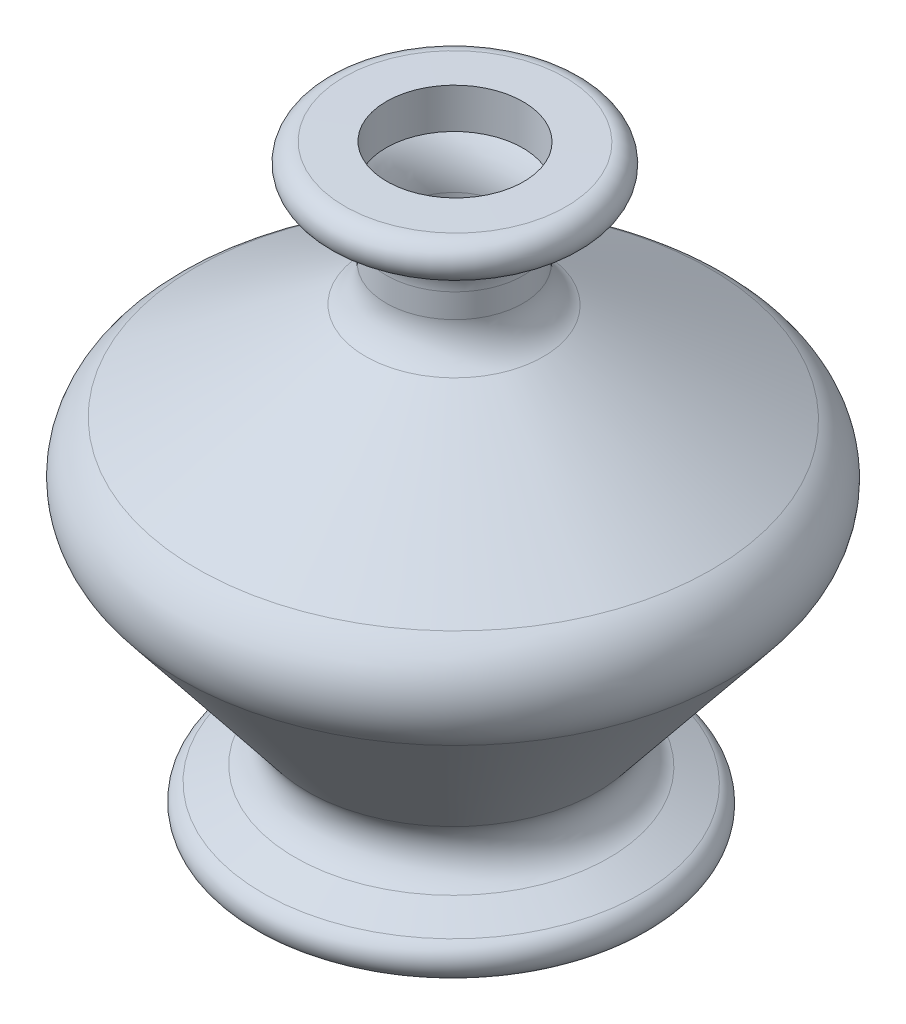
from build123d import *


with BuildPart() as part:
    # Sketch1 → Revolve1 (revolve)
    with BuildSketch(Plane.XY):
        with BuildLine():
            ThreePointArc((-30.112804191, 46.969682677), (-21.984957877, 43.22770443), (-18.705713585, 34.902390995))
            Line((-18.705713585, 34.902390995), (-18.750262239, 28.378005059))
            ThreePointArc((-18.750262239, 28.378005059), (-20.276474461, 22.796589902), (-24.375, 18.712032728))
            Line((-24.375, 18.712032728), (-70.25, -7.773910871))
            ThreePointArc((-70.25, -7.773910871), (-77.957800408, -18.586470041), (-74.846753704, -31.495498329))
            Line((-74.846753704, -31.495498329), (-40.164326041, -75.78115302))
            ThreePointArc((-40.164326041, -75.78115302), (-38.512004339, -83.486107634), (-43.558434277, -89.53838303))
            Line((-43.558434277, -89.53838303), (-52.300869846, -93.470280832))
            ThreePointArc((-52.300869846, -93.470280832), (-55.138771957, -99.079082678), (-50.25, -103.030317332))
            Line((-50.25, -103.030317332), (-1.091618523, -103.030317332))
            Line((-1.091618523, -103.030317332), (-1.061575225, -98.630317332))
            Line((-1.061575225, -98.630317332), (-50.25, -98.630317332))
            ThreePointArc((-50.25, -98.630317332), (-50.836652635, -98.156169173), (-50.496104382, -97.483112952))
            Line((-50.496104382, -97.483112952), (-41.753668813, -93.55121515))
            ThreePointArc((-41.753668813, -93.55121515), (-34.240095349, -84.540049559), (-36.700218773, -73.068228246))
            Line((-36.700218773, -73.068228246), (-71.382646435, -28.782573555))
            ThreePointArc((-71.382646435, -28.782573555), (-73.638155296, -19.423528046), (-68.05, -11.584422648))
            Line((-68.05, -11.584422648), (-22.175, 14.901520951))
            ThreePointArc((-22.175, 14.901520951), (-16.473495584, 20.58359382), (-14.350364804, 28.34796246))
            Line((-14.350364804, 28.34796246), (-14.30581615, 34.872348397))
            ThreePointArc((-14.30581615, 34.872348397), (-15.404370627, 40.886652338), (-18.629387968, 46.080681312))
            Line((-18.629387968, 46.080681312), (-18.623317847, 46.969682677))
            Line((-18.623317847, 46.969682677), (-18.555037622, 56.969682677))
            Line((-18.555037622, 56.969682677), (-30, 56.969682677))
            ThreePointArc((-30, 56.969682677), (-34.998923216, 52.073445297), (-30.207480548, 46.973989349))
            ThreePointArc((-30.207480548, 46.973989349), (-30.10376262, 46.970759461), (-30, 46.969682677))
            Line((-30, 46.969682677), (-30.112804191, 46.969682677))
        make_face()
    revolve(axis=Axis((-1.061575225, -98.630317332, 0), (-0.0068278633025588885, -0.9999766898696797, 0)))


solid = part.part
